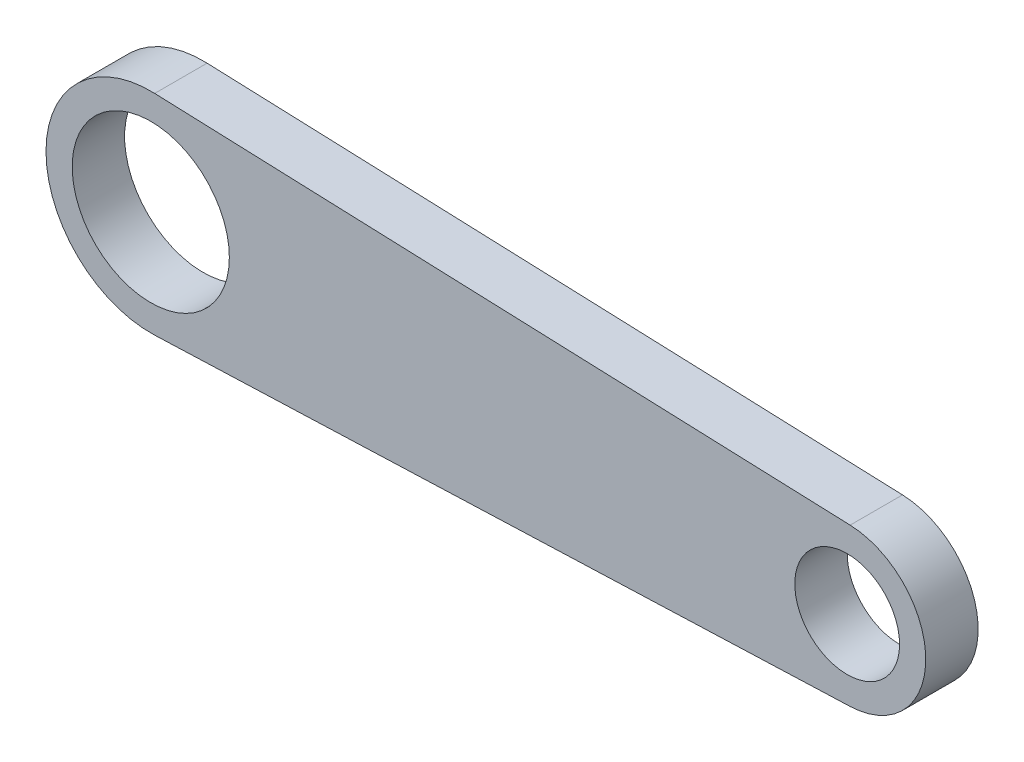
from build123d import *

# Parameters (mm, degrees)
SKETCH1_R           = 15
SKETCH1_R_2         = 10
BOSS_EXTRUDE1_DEPTH = 10


with BuildPart() as part:
    # Sketch1 → Boss-Extrude1 (new body)
    with BuildSketch(Plane.XY):
        with BuildLine():
            Line((-65.717780954, 19.985849157), (67.034164285, 14.989386867))
            ThreePointArc((67.034164285, 14.989386867), (81.47, 0), (67.034164285, -14.989386867))
            Line((67.034164285, -14.989386867), (-65.717780954, -19.985849157))
            ThreePointArc((-65.717780954, -19.985849157), (-86.47, 0), (-65.717780954, 19.985849157))
        make_face()
        with Locations((-66.47, 0)):
            Circle(SKETCH1_R, mode=Mode.SUBTRACT)
        with Locations((66.47, 0)):
            Circle(SKETCH1_R_2, mode=Mode.SUBTRACT)
    extrude(amount=BOSS_EXTRUDE1_DEPTH)


solid = part.part
